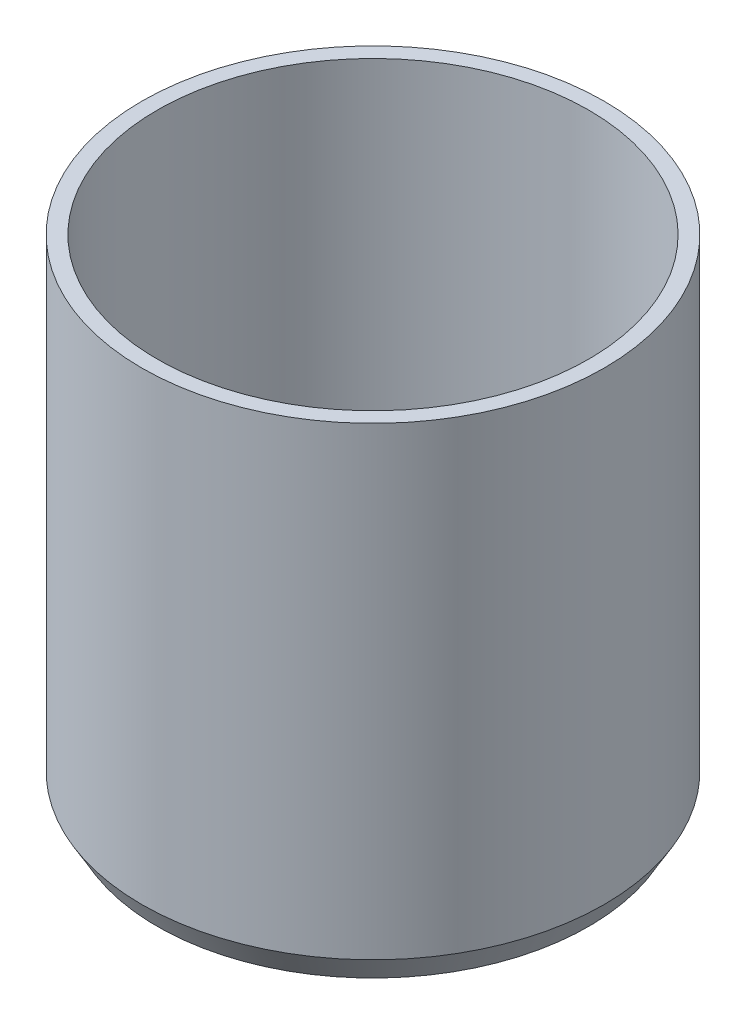
from build123d import *


with BuildPart() as part:
    # Sketch4 → Revolve1 (revolve)
    with BuildSketch(Plane.XY, mode=Mode.PRIVATE) as revolve1_sk:
        Polygon((0, 0), (70, 0), (75, 8.660254038), (75, 98.660254038), (75, 159.39768106), (70, 159.39768106), (70, 98.660254038), (70, 11.828066939), (67.405794607, 5), (0, 5), align=None)
    revolve(revolve1_sk.sketch.rotate(Axis((0, 0, 0), (0, 1, 0)), 90), axis=Axis((0, 0, 0), (0, 1, 0)))


solid = part.part
